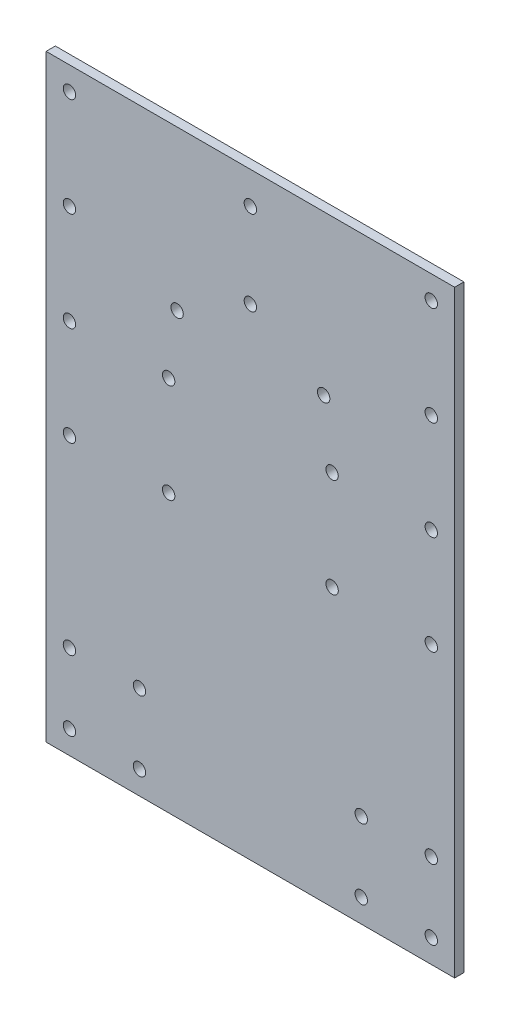
from build123d import *

# Parameters (mm, degrees)
SKETCH1_W           = 140
SKETCH1_H           = 205
SKETCH1_R           = 2.125
BOSS_EXTRUDE1_DEPTH = 3.175
SKETCH2_R           = 2.125
CUT_EXTRUDE1_DEPTH  = 125.162516989


with BuildPart() as part:
    # Sketch1 → Boss-Extrude1 (new body)
    with BuildSketch(Plane.XY):
        Rectangle(SKETCH1_W, SKETCH1_H)
        with Locations((0, 91.5)):
            Circle(SKETCH1_R, mode=Mode.SUBTRACT)
        with Locations((25.11473671, 48)):
            Circle(SKETCH1_R, mode=Mode.SUBTRACT)
        with Locations((-25.11473671, 48)):
            Circle(SKETCH1_R, mode=Mode.SUBTRACT)
        with Locations((0, 62.5)):
            Circle(SKETCH1_R, mode=Mode.SUBTRACT)
        with Locations((-62, -94.5)):
            Circle(SKETCH1_R, mode=Mode.SUBTRACT)
        with Locations(Location((-38, -94.5, 0), (0, 0, 180))):
            Circle(SKETCH1_R, mode=Mode.SUBTRACT)
        with Locations((-38, -70.5)):
            Circle(SKETCH1_R, mode=Mode.SUBTRACT)
        with Locations(Location((-62, -70.5, 0), (0, 0, 180))):
            Circle(SKETCH1_R, mode=Mode.SUBTRACT)
        with Locations((38, -94.5)):
            Circle(SKETCH1_R, mode=Mode.SUBTRACT)
        with Locations(Location((62, -94.5, 0), (0, 0, 180))):
            Circle(SKETCH1_R, mode=Mode.SUBTRACT)
        with Locations((62, -70.5)):
            Circle(SKETCH1_R, mode=Mode.SUBTRACT)
        with Locations(Location((38, -70.5, 0), (0, 0, 180))):
            Circle(SKETCH1_R, mode=Mode.SUBTRACT)
    extrude(amount=BOSS_EXTRUDE1_DEPTH)

    # Sketch2 → Cut-Extrude1 (cut, through all)
    with BuildSketch(Plane.XY.offset(3.175)):
        with Locations((-62, 94.5)):
            Circle(SKETCH2_R)
        with Locations((-62, 60.5)):
            Circle(SKETCH2_R)
        with Locations((-62, 26.5)):
            Circle(SKETCH2_R)
        with Locations((-62, -7.5)):
            Circle(SKETCH2_R)
        with Locations((-28, 26.5)):
            Circle(SKETCH2_R)
        with Locations((-28, -7.5)):
            Circle(SKETCH2_R)
        with Locations(Location((28, -7.5, 0), (0, 0, 180))):
            Circle(SKETCH2_R)
        with Locations(Location((28, 26.5, 0), (0, 0, 180))):
            Circle(SKETCH2_R)
        with Locations(Location((62, -7.5, 0), (0, 0, 180))):
            Circle(SKETCH2_R)
        with Locations(Location((62, 26.5, 0), (0, 0, 180))):
            Circle(SKETCH2_R)
        with Locations(Location((62, 60.5, 0), (0, 0, 180))):
            Circle(SKETCH2_R)
        with Locations(Location((62, 94.5, 0), (0, 0, 180))):
            Circle(SKETCH2_R)
    extrude(amount=-CUT_EXTRUDE1_DEPTH, mode=Mode.SUBTRACT)


solid = part.part
